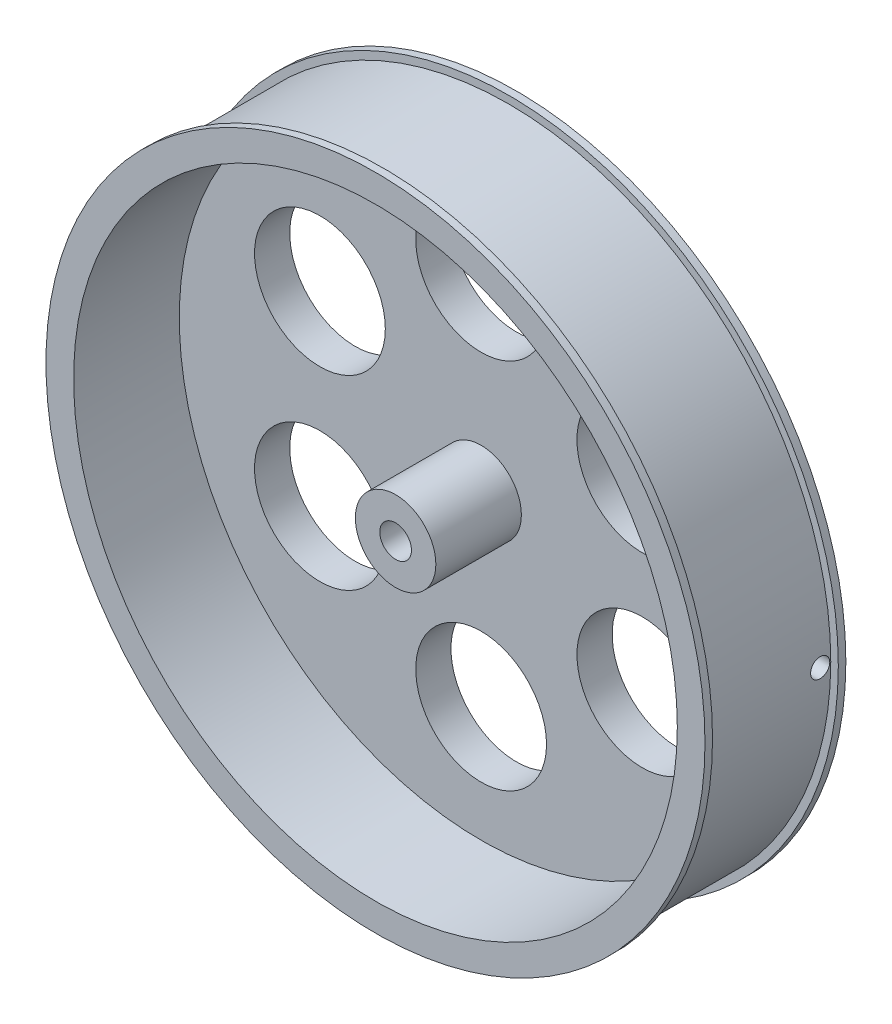
from build123d import *

# Parameters (mm, degrees)
SKETCH1_R              = 64
SKETCH1_R_2            = 60
RIM_DEPTH              = 28
SKETCH2_R              = 65.5
SKETCH2_R_2            = 63
INNER_BEAD_LIP_DEPTH   = 1.5
SKETCH3_R              = 65.5
SKETCH3_R_2            = 63
OUTER_BEAD_LIP_DEPTH   = 1.5
SKETCH4_R              = 61
WEB_DEPTH              = 7
SKETCH5_R              = 8
HUB_BOSS_DEPTH         = 24
SKETCH6_R              = 13
LIGHTENING_HOLES_DEPTH = 9
SKETCH7_R              = 3.15
ROUND_BORE_6MM_DEPTH   = 30
SKETCH8_R              = 1.3
GRUB_SCREW_M3_DEPTH    = 9
SKETCH9_R              = 1.9
GRUB_KEY_ACCESS_DEPTH  = 57.5


with BuildPart() as part:
    # Sketch1 → Rim (new body)
    with BuildSketch(Plane.XY):
        Circle(SKETCH1_R)
        Circle(SKETCH1_R_2, mode=Mode.SUBTRACT)
    extrude(amount=RIM_DEPTH)

    # Sketch2 → Inner_bead_lip (add)
    with BuildSketch(Plane.XY):
        Circle(SKETCH2_R)
        Circle(SKETCH2_R_2, mode=Mode.SUBTRACT)
    extrude(amount=INNER_BEAD_LIP_DEPTH)

    # Sketch3 → Outer_bead_lip (add)
    with BuildSketch(Plane.XY.offset(26.5)):
        Circle(SKETCH3_R)
        Circle(SKETCH3_R_2, mode=Mode.SUBTRACT)
    extrude(amount=OUTER_BEAD_LIP_DEPTH)

    # Sketch4 → Web (add)
    with BuildSketch(Plane.XY):
        Circle(SKETCH4_R)
    extrude(amount=WEB_DEPTH)

    # Sketch5 → Hub_boss (add)
    with BuildSketch(Plane.XY):
        Circle(SKETCH5_R)
    extrude(amount=HUB_BOSS_DEPTH)

    # Sketch6 → Lightening_holes (cut)
    with BuildSketch(Plane.XY.offset(-1)):
        with Locations((32.04293994, 18.5)):
            Circle(SKETCH6_R)
        with Locations((0, 37)):
            Circle(SKETCH6_R)
        with Locations((-32.04293994, 18.5)):
            Circle(SKETCH6_R)
        with Locations((-32.04293994, -18.5)):
            Circle(SKETCH6_R)
        with Locations((0, -37)):
            Circle(SKETCH6_R)
        with Locations((32.04293994, -18.5)):
            Circle(SKETCH6_R)
    extrude(amount=LIGHTENING_HOLES_DEPTH, mode=Mode.SUBTRACT)

    # Sketch7 → Round_bore_6mm (cut)
    with BuildSketch(Plane.XY.offset(-1)):
        Circle(SKETCH7_R)
    extrude(amount=ROUND_BORE_6MM_DEPTH, mode=Mode.SUBTRACT)

    # Sketch8 → Grub_screw_M3 (cut)
    with BuildSketch(Plane(origin=(0, 0, 0), x_dir=(0, 0, -1), z_dir=(1, 0, 0))):
        with Locations((-3.6, 0)):
            Circle(SKETCH8_R)
    extrude(amount=GRUB_SCREW_M3_DEPTH, mode=Mode.SUBTRACT)

    # Sketch9 → Grub_key_access (cut)
    with BuildSketch(Plane(origin=(8.5, 0, 0), x_dir=(0, 0, -1), z_dir=(1, 0, 0))):
        with Locations((-3.6, 0)):
            Circle(SKETCH9_R)
    extrude(amount=GRUB_KEY_ACCESS_DEPTH, mode=Mode.SUBTRACT)


solid = part.part
